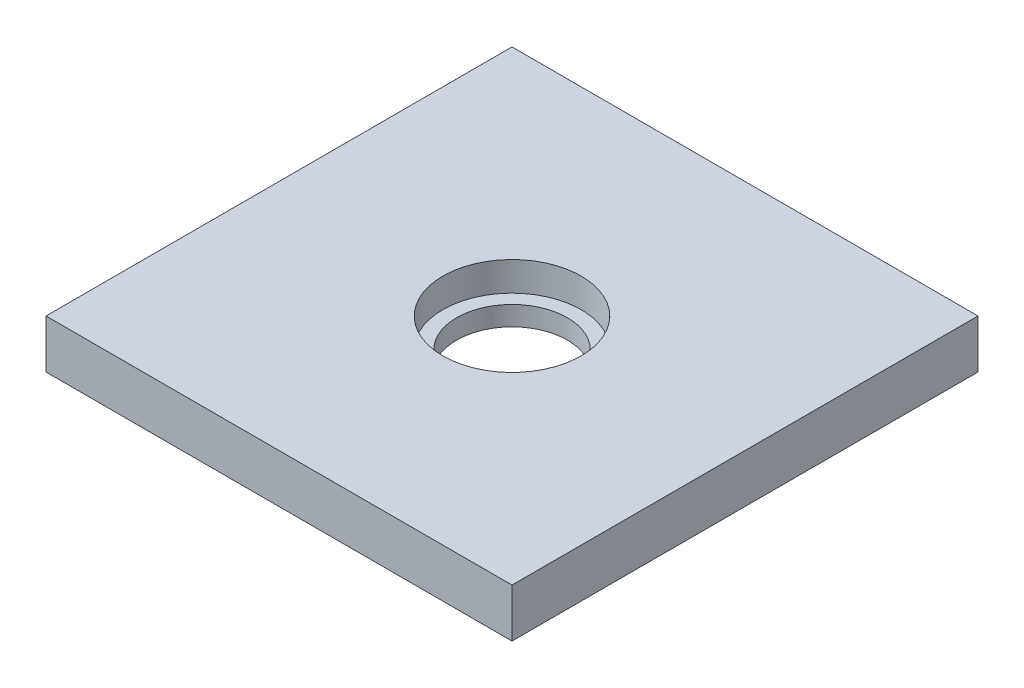
from build123d import *

# Parameters (mm, degrees)
SKETCH3_W           = 152.4
SKETCH3_H           = 15.875
BOSS_EXTRUDE1_DEPTH = 76.2
SKETCH4_R           = 22.621875
CUT_EXTRUDE1_DEPTH  = 9.525
SKETCH5_R           = 18.0975
CUT_EXTRUDE2_DEPTH  = 109.183203987


with BuildPart() as part:
    # Sketch3 → Boss-Extrude1 (new, symmetric)
    with BuildSketch(Plane.XY):
        Rectangle(SKETCH3_W, SKETCH3_H)
    extrude(amount=BOSS_EXTRUDE1_DEPTH, both=True)

    # Sketch4 → Cut-Extrude1 (cut)
    with BuildSketch(Plane(origin=(0, 7.9375, 0), x_dir=(1, 0, 0), z_dir=(0, 1, 0))):
        with Locations(Location((0, 0, 0), (0, 0, 270))):
            Circle(SKETCH4_R)
    extrude(amount=-CUT_EXTRUDE1_DEPTH, mode=Mode.SUBTRACT)

    # Sketch5 → Cut-Extrude2 (cut, through all)
    with BuildSketch(Plane(origin=(0, -1.5875, 0), x_dir=(1, 0, 0), z_dir=(0, 1, 0))):
        with Locations(Location((0, 0, 0), (0, 0, 270))):
            Circle(SKETCH5_R)
    extrude(amount=-CUT_EXTRUDE2_DEPTH, mode=Mode.SUBTRACT)


solid = part.part
